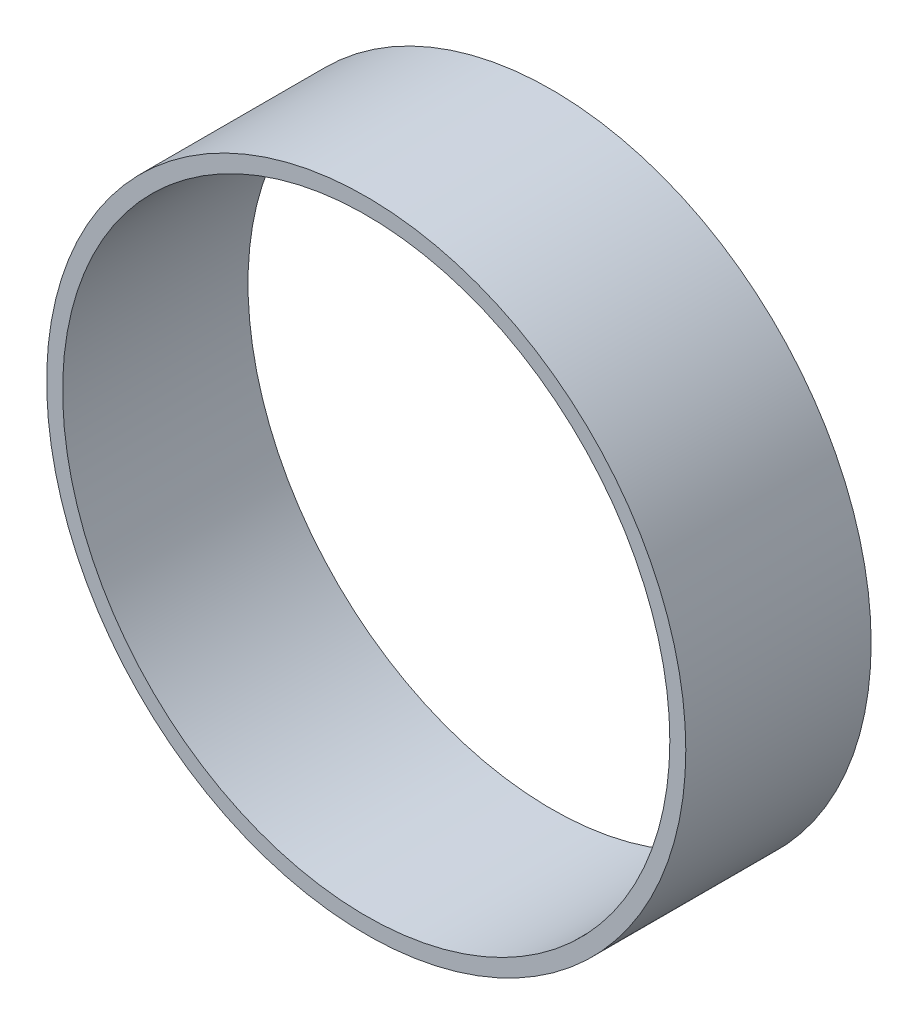
from build123d import *

# Parameters (mm, degrees)
SKETCH1_R           = 10
BOSS_EXTRUDE1_DEPTH = 5.8
SKETCH2_R           = 9.5
CUT_EXTRUDE1_DEPTH  = 5.8


with BuildPart() as part:
    # Sketch1 → Boss-Extrude1 (new body)
    with BuildSketch(Plane.XY):
        with Locations((-43.212664647, 1.441865661)):
            Circle(SKETCH1_R)
    extrude(amount=BOSS_EXTRUDE1_DEPTH)

    # Sketch2 → Cut-Extrude1 (cut)
    with BuildSketch(Plane.XY.offset(5.8)):
        with Locations((-43.212664647, 1.441865661)):
            Circle(SKETCH2_R)
    extrude(amount=-CUT_EXTRUDE1_DEPTH, mode=Mode.SUBTRACT)


solid = part.part
